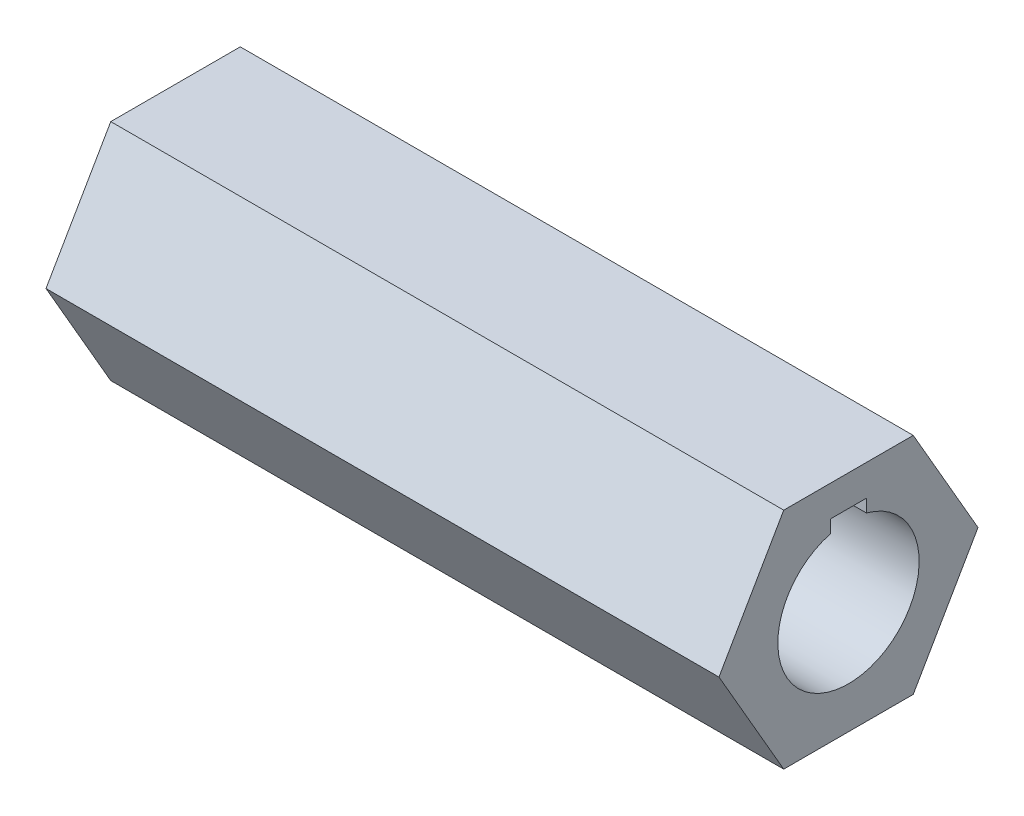
from build123d import *

# Parameters (mm, degrees)
BOSS_EXTRUDE1_DEPTH = 38.1
SKETCH2_R           = 4
CUT_EXTRUDE1_DEPTH  = 40.315338398
SKETCH3_W           = 2.032
SKETCH3_H           = 1.1938
CUT_EXTRUDE2_DEPTH  = 40.315338398


with BuildPart() as part:
    # Sketch1 → Boss-Extrude1 (new body)
    with BuildSketch(Plane(origin=(0, 0, 0), x_dir=(0, 0, -1), z_dir=(1, 0, 0))):
        Polygon((7.332348419, 0), (3.666174209, 6.35), (-3.666174209, 6.35), (-7.332348419, 0), (-3.666174209, -6.35), (3.666174209, -6.35), align=None)
    extrude(amount=BOSS_EXTRUDE1_DEPTH)

    # Sketch2 → Cut-Extrude1 (cut, through all)
    with BuildSketch(Plane(origin=(38.1, 0, 0), x_dir=(0, 0, -1), z_dir=(1, 0, 0))):
        Circle(SKETCH2_R)
    extrude(amount=-CUT_EXTRUDE1_DEPTH, mode=Mode.SUBTRACT)

    # Sketch3 → Cut-Extrude2 (cut, through all)
    with BuildSketch(Plane.ZY):
        with Locations((0, 4)):
            Rectangle(SKETCH3_W, SKETCH3_H)
    extrude(amount=-CUT_EXTRUDE2_DEPTH, mode=Mode.SUBTRACT)


solid = part.part
